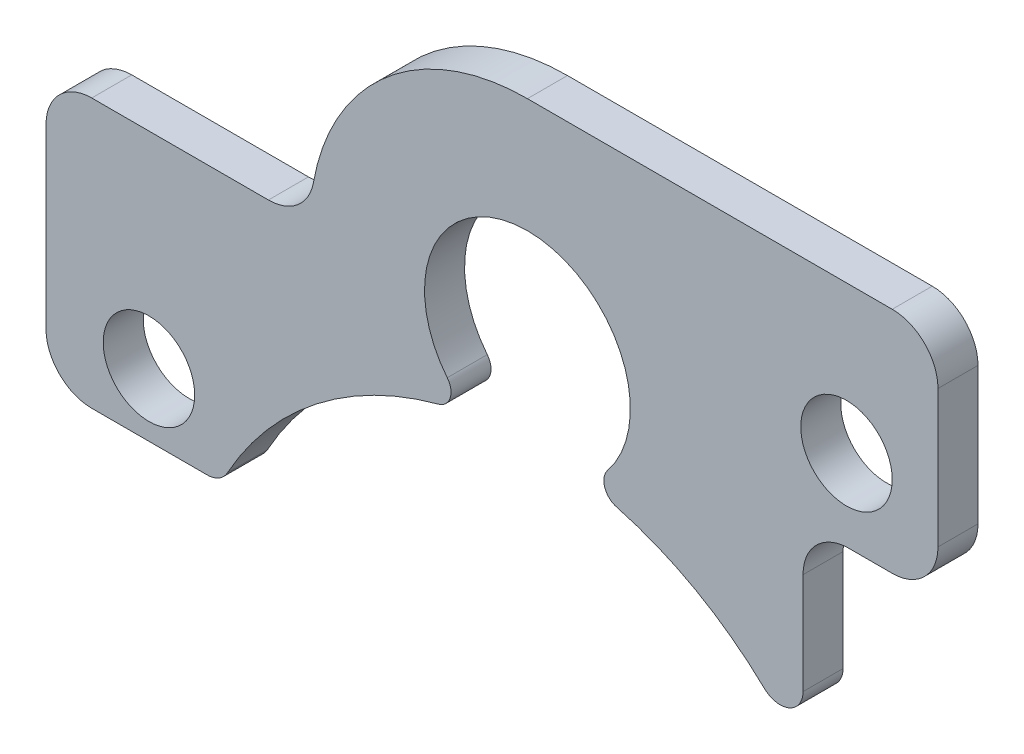
from build123d import *

# Parameters (mm, degrees)
SKETCH1_R           = 2
BOSS_EXTRUDE2_DEPTH = 1.75


with BuildPart() as part:
    # Sketch1 → Boss-Extrude2 (new body)
    with BuildSketch(Plane.XY):
        with BuildLine():
            Line((0, 9.5), (15.95, 9.5))
            ThreePointArc((15.95, 9.5), (17.364213562, 8.914213562), (17.95, 7.5))
            Line((17.95, 7.5), (17.95, 1.5))
            ThreePointArc((17.95, 1.5), (17.364213562, 0.085786438), (15.95, -0.5))
            Line((15.95, -0.5), (14.05, -0.5))
            ThreePointArc((14.05, -0.5), (12.635786438, -1.085786438), (12.05, -2.5))
            Line((12.05, -2.5), (12.05, -2.621320344))
            Line((12.05, -2.621320344), (12.05, -6.92859127))
            ThreePointArc((12.05, -6.92859127), (11.443303318, -7.848000047), (10.359375, -7.651804315))
            ThreePointArc((10.359375, -7.651804315), (7.356020854, -5.427549686), (3.896023084, -4.014800515))
            ThreePointArc((3.896023084, -4.014800515), (3.377802295, -3.523133979), (3.506420776, -2.82046332))
            ThreePointArc((3.506420776, -2.82046332), (4.482227913, -0.399540902), (3.95, 2.155806114))
            ThreePointArc((3.95, 2.155806114), (-2.498000201, 3.742992786), (-3.506420776, -2.82046332))
            ThreePointArc((-3.506420776, -2.82046332), (-3.377802295, -3.523133979), (-3.896023084, -4.014800515))
            ThreePointArc((-3.896023084, -4.014800515), (-9.243460442, -6.686514525), (-13.122907199, -11.234375))
            ThreePointArc((-13.122907199, -11.234375), (-13.490015279, -11.611503047), (-13.997767679, -11.75))
            Line((-13.997767679, -11.75), (-19.05, -11.75))
            ThreePointArc((-19.05, -11.75), (-20.464213562, -11.164213562), (-21.05, -9.75))
            Line((-21.05, -9.75), (-21.05, -2))
            ThreePointArc((-21.05, -2), (-20.464213562, -0.585786438), (-19.05, 0))
            Line((-19.05, 0), (-11.324751653, 0))
            ThreePointArc((-11.324751653, 0), (-10.039382479, 0.467738245), (-9.355229626, 1.652173913))
            ThreePointArc((-9.355229626, 1.652173913), (-6.105503576, 7.278243338), (0, 9.5))
        make_face()
        with Locations((-16.55, -9)):
            Circle(SKETCH1_R, mode=Mode.SUBTRACT)
        with Locations((13.95, 3.05)):
            Circle(SKETCH1_R, mode=Mode.SUBTRACT)
    extrude(amount=BOSS_EXTRUDE2_DEPTH)


solid = part.part
